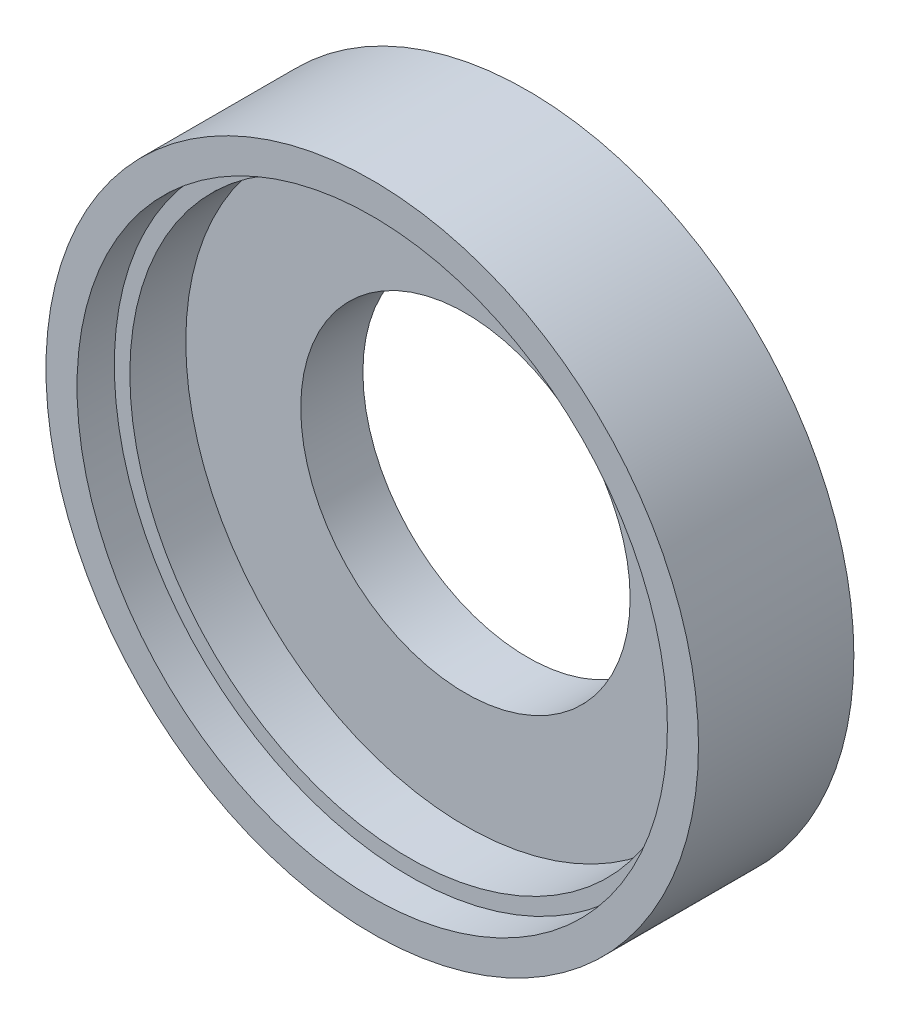
from build123d import *

# Parameters (mm, degrees)
SKETCH2_R           = 52.5
SKETCH2_R_2         = 47.5
BOSS_EXTRUDE1_DEPTH = 25
SKETCH2_6_R         = 47.5
SKETCH2_6_R_2       = 45
BOSS_EXTRUDE5_DEPTH = 19
SKETCH2_7_R         = 45
SKETCH2_7_R_2       = 26.5
BOSS_EXTRUDE6_DEPTH = 10


with BuildPart() as part:
    # Sketch2 → Boss-Extrude1 (new body)
    with BuildSketch(Plane.XY):
        Circle(SKETCH2_R)
        Circle(SKETCH2_R_2, mode=Mode.SUBTRACT)
    extrude(amount=BOSS_EXTRUDE1_DEPTH)

    # Sketch2<6> → Boss-Extrude5 (add)
    with BuildSketch(Plane.XY):
        Circle(SKETCH2_6_R)
        Circle(SKETCH2_6_R_2, mode=Mode.SUBTRACT)
    extrude(amount=BOSS_EXTRUDE5_DEPTH)

    # Sketch2<7> → Boss-Extrude6 (add)
    with BuildSketch(Plane.XY):
        Circle(SKETCH2_7_R)
        Circle(SKETCH2_7_R_2, mode=Mode.SUBTRACT)
    extrude(amount=BOSS_EXTRUDE6_DEPTH)


solid = part.part
